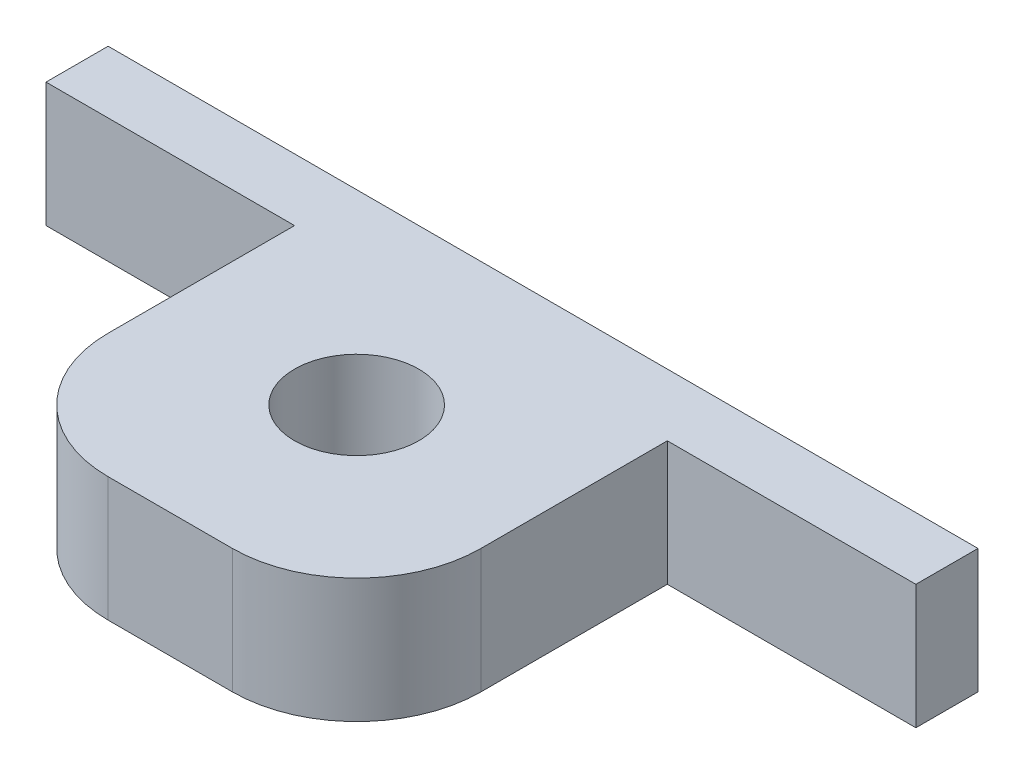
from build123d import *

# Parameters (mm, degrees)
SKETCH1_R           = 10
BOSS_EXTRUDE1_DEPTH = 10
FILLET1_R           = 20


with BuildPart() as part:
    # Sketch1 → Boss-Extrude1 (new, symmetric)
    with BuildSketch(Plane(origin=(0, 0, 0), x_dir=(-1, 0, 0), z_dir=(0, 1, 0))):
        Polygon((-70, 0), (70, 0), (70, 10), (30, 10), (30, 60), (-30, 60), (-30, 10), (-70, 10), align=None)
        with Locations(Location((0, 30, 0), (0, 0, 90))):
            Circle(SKETCH1_R, mode=Mode.SUBTRACT)
    extrude(amount=BOSS_EXTRUDE1_DEPTH, both=True)

    # Fillet1
    fillet1_edges = [part.edges().sort_by_distance(p)[0] for p in [
        (30, 0, 60),
        (-30, 0, 60),
    ]]
    fillet(fillet1_edges, radius=FILLET1_R)


solid = part.part
